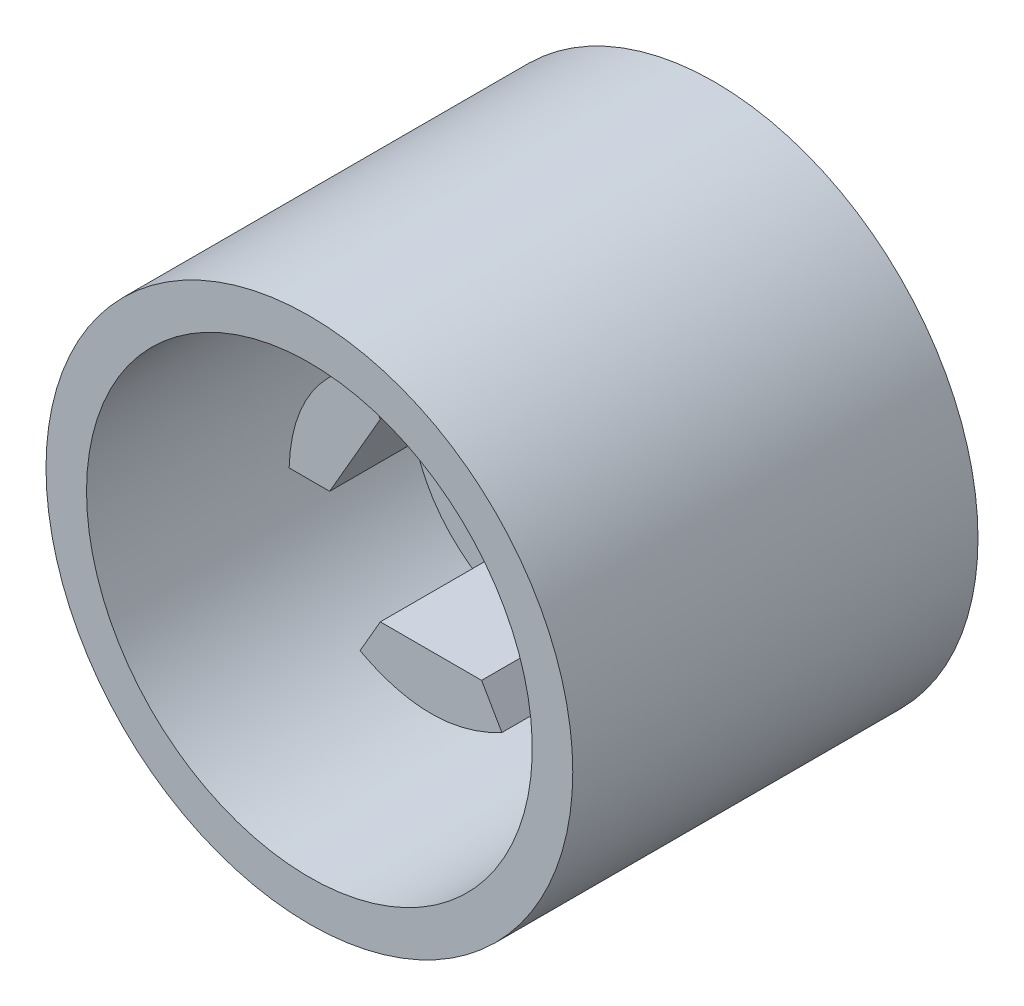
from build123d import *

# Parameters (mm, degrees)
EXTRUDE_THIN1_DEPTH = 4.7625
BOSS_EXTRUDE3_DEPTH = 4.7625
BOSS_EXTRUDE4_DEPTH = 4.7625
BOSS_EXTRUDE5_DEPTH = 4.7625


with BuildPart() as part:
    # Sketch1 → Revolve1 (revolve)
    with BuildSketch(Plane(origin=(0, 0, 0), x_dir=(1, 0, 0), z_dir=(0, 1, 0)), mode=Mode.PRIVATE) as revolve1_sk:
        Polygon((3.889458747, 12.636440067), (-4.841791253, 12.636440067), (-4.841791253, 11.048940067), (-0.873041253, 11.048940067), (-0.873041253, 6.286440067), (0.714458747, 6.286440067), (0.714458747, 11.048940067), (3.889458747, 11.048940067), (3.889458747, -3.238559933), (5.476958747, -3.238559933), (5.476958747, 12.636440067), align=None)
    revolve(revolve1_sk.sketch.rotate(Axis((-4.841791253, 0, -12.636440067), (0, 0, 1)), 180), axis=Axis((-4.841791253, 0, -12.636440067), (0, 0, 1)))

    # Sketch3 → Extrude-Thin1 (add)
    with BuildSketch(Plane.XY.offset(-11.048940067)):
        Polygon((0.593428431, 0), (-2.124181411, 4.707038321), (-7.559401095, 4.707038321), (-10.277010937, 0), (-7.559401095, -4.707038321), (-2.124181411, -4.707038321), align=None)
        Polygon((-0.873041253, 0), (-2.857416253, 3.437038321), (-6.826166253, 3.437038321), (-8.810541253, 0), (-6.826166253, -3.437038321), (-2.857416253, -3.437038321), align=None, mode=Mode.SUBTRACT)
    extrude(amount=EXTRUDE_THIN1_DEPTH)

    # Sketch4 → Boss-Extrude3 (add)
    with BuildSketch(Plane.XY.offset(-6.286440067)):
        with BuildLine():
            Line((-8.810541253, 0), (-10.398041253, 0))
            add(Edge.make_bspline(
                [(-7.619916253, 4.81185365), (-10.301123719, 3.145408418), (-10.398041253, 0)],
                knots=[0, 0, 0, 1, 1, 1], degree=2))
            Line((-7.619916253, 4.81185365), (-6.826166253, 3.437038321))
            Line((-6.826166253, 3.437038321), (-8.810541253, 0))
        make_face()
    extrude(amount=BOSS_EXTRUDE3_DEPTH)

    # Sketch6 → Boss-Extrude4 (add)
    with BuildSketch(Plane.XY.offset(-6.286440067)):
        with BuildLine():
            Line((-2.857416253, 3.437038321), (-2.063666253, 4.81185365))
            add(Edge.make_bspline(
                [(-2.063666253, 4.81185365), (0.618739425, 3.143288031), (0.714458747, 0)],
                knots=[0, 0, 0, 1, 1, 1], degree=2))
            Line((0.714458747, 0), (-0.873041253, 0))
            Line((-0.873041253, 0), (-2.857416253, 3.437038321))
        make_face()
    extrude(amount=BOSS_EXTRUDE4_DEPTH)

    # Sketch7 → Boss-Extrude5 (add)
    with BuildSketch(Plane.XY.offset(-6.286440067)):
        with BuildLine():
            Line((-6.826166253, -3.437038321), (-7.619916253, -4.81185365))
            add(Edge.make_bspline(
                [(-7.619916253, -4.81185365), (-4.841791253, -6.30064635), (-2.063666253, -4.81185365)],
                knots=[0, 0, 0, 1, 1, 1], degree=2))
            Line((-2.063666253, -4.81185365), (-2.857416253, -3.437038321))
            Line((-2.857416253, -3.437038321), (-6.826166253, -3.437038321))
        make_face()
    extrude(amount=BOSS_EXTRUDE5_DEPTH)


solid = part.part
